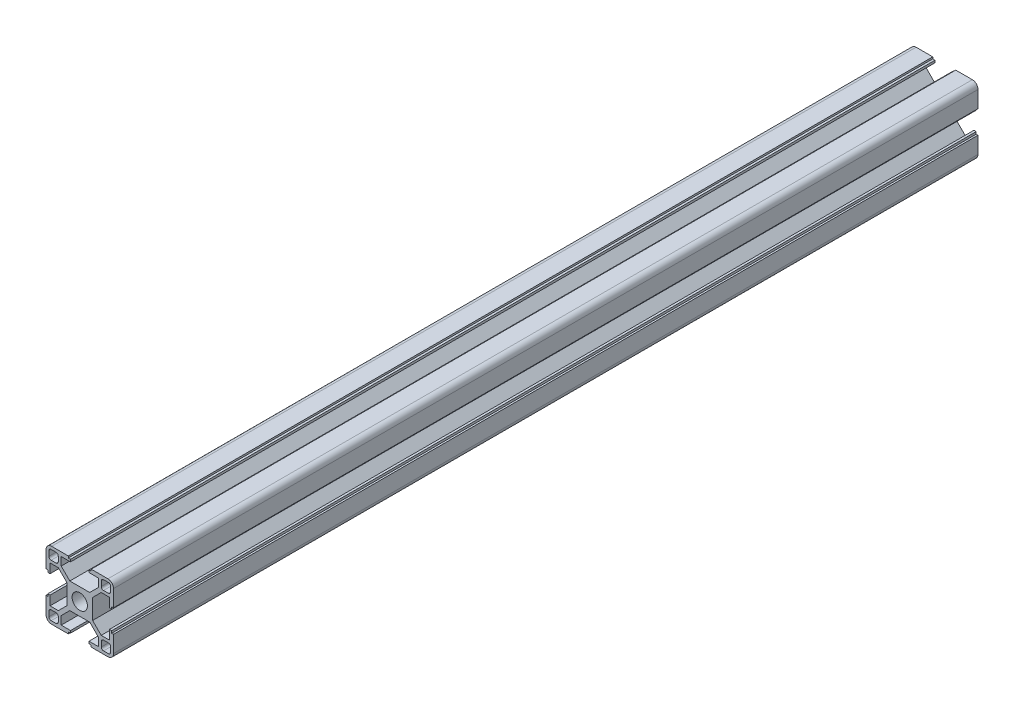
from build123d import *

# Parameters (mm, degrees)
SKETCH1_R      = 3.4
EXTRUDE1_DEPTH = 384
EXTRUDE2_DEPTH = 385.585491146


with BuildPart() as part:
    # Sketch1 → Extrude1 (new body)
    with BuildSketch(Plane.XY):
        with BuildLine():
            Line((-5.1, 14.2), (-5.1, 15))
            Line((-5.1, 15), (-12.5, 15))
            ThreePointArc((-12.5, 15), (-14.267766953, 14.267766953), (-15, 12.5))
            Line((-15, 12.5), (-15, 5.1))
            Line((-15, 5.1), (-14.2, 5.1))
            Line((-14.2, 5.1), (-14.2, 4.1))
            Line((-14.2, 4.1), (-13.2, 4.1))
            Line((-13.2, 4.1), (-13.2, 8.25))
            Line((-13.2, 8.25), (-9.522792206, 8.25))
            Line((-9.522792206, 8.25), (-5.7, 4.427207794))
            Line((-5.7, 4.427207794), (-5.7, -4.427207794))
            Line((-5.7, -4.427207794), (-9.522792206, -8.25))
            Line((-9.522792206, -8.25), (-13.2, -8.25))
            Line((-13.2, -8.25), (-13.2, -4.1))
            Line((-13.2, -4.1), (-14.2, -4.1))
            Line((-14.2, -4.1), (-14.2, -5.1))
            Line((-14.2, -5.1), (-15, -5.1))
            Line((-15, -5.1), (-15, -12.5))
            ThreePointArc((-15, -12.5), (-14.267766953, -14.267766953), (-12.5, -15))
            Line((-12.5, -15), (-5.1, -15))
            Line((-5.1, -15), (-5.1, -14.2))
            Line((-5.1, -14.2), (-4.1, -14.2))
            Line((-4.1, -14.2), (-4.1, -13.2))
            Line((-4.1, -13.2), (-8.25, -13.2))
            Line((-8.25, -13.2), (-8.25, -9.522792206))
            Line((-8.25, -9.522792206), (-4.427207794, -5.7))
            Line((-4.427207794, -5.7), (4.427207794, -5.7))
            Line((4.427207794, -5.7), (8.25, -9.522792206))
            Line((8.25, -9.522792206), (8.25, -13.2))
            Line((8.25, -13.2), (4.1, -13.2))
            Line((4.1, -13.2), (4.1, -14.2))
            Line((4.1, -14.2), (5.1, -14.2))
            Line((5.1, -14.2), (5.1, -15))
            Line((5.1, -15), (12.5, -15))
            ThreePointArc((12.5, -15), (14.267766953, -14.267766953), (15, -12.5))
            Line((15, -12.5), (15, -5.1))
            Line((15, -5.1), (14.2, -5.1))
            Line((14.2, -5.1), (14.2, -4.1))
            Line((14.2, -4.1), (13.2, -4.1))
            Line((13.2, -4.1), (13.2, -8.25))
            Line((13.2, -8.25), (9.522792206, -8.25))
            Line((9.522792206, -8.25), (5.7, -4.427207794))
            Line((5.7, -4.427207794), (5.7, 4.427207794))
            Line((5.7, 4.427207794), (9.522792206, 8.25))
            Line((9.522792206, 8.25), (13.2, 8.25))
            Line((13.2, 8.25), (13.2, 4.1))
            Line((13.2, 4.1), (14.2, 4.1))
            Line((14.2, 4.1), (14.2, 5.1))
            Line((14.2, 5.1), (15, 5.1))
            Line((15, 5.1), (15, 12.5))
            ThreePointArc((15, 12.5), (14.267766953, 14.267766953), (12.5, 15))
            Line((12.5, 15), (5.1, 15))
            Line((5.1, 15), (5.1, 14.2))
            Line((5.1, 14.2), (4.1, 14.2))
            Line((4.1, 14.2), (4.1, 13.2))
            Line((4.1, 13.2), (8.25, 13.2))
            Line((8.25, 13.2), (8.25, 9.522792206))
            Line((8.25, 9.522792206), (4.427207794, 5.7))
            Line((4.427207794, 5.7), (-4.427207794, 5.7))
            Line((-4.427207794, 5.7), (-8.25, 9.522792206))
            Line((-8.25, 9.522792206), (-8.25, 13.2))
            Line((-8.25, 13.2), (-4.1, 13.2))
            Line((-4.1, 13.2), (-4.1, 14.2))
            Line((-4.1, 14.2), (-5.1, 14.2))
        make_face()
        Circle(SKETCH1_R, mode=Mode.SUBTRACT)
    extrude(amount=EXTRUDE1_DEPTH)

    # Sketch2 → Extrude2 (cut, through all)
    with BuildSketch(Plane.XY.offset(384)):
        with BuildLine():
            Line((13.7, 12.7), (13.7, 10.55))
            ThreePointArc((13.7, 10.55), (13.407106781, 9.842893219), (12.7, 9.55))
            Line((12.7, 9.55), (10.55, 9.55))
            ThreePointArc((10.55, 9.55), (9.842893219, 9.842893219), (9.55, 10.55))
            Line((9.55, 10.55), (9.55, 12.7))
            ThreePointArc((9.55, 12.7), (9.842893219, 13.407106781), (10.55, 13.7))
            Line((10.55, 13.7), (12.7, 13.7))
            ThreePointArc((12.7, 13.7), (13.407106781, 13.407106781), (13.7, 12.7))
        make_face()
        with BuildLine():
            Line((-12.7, 13.7), (-10.55, 13.7))
            ThreePointArc((-10.55, 13.7), (-9.842893219, 13.407106781), (-9.55, 12.7))
            Line((-9.55, 12.7), (-9.55, 10.55))
            ThreePointArc((-9.55, 10.55), (-9.842893219, 9.842893219), (-10.55, 9.55))
            Line((-10.55, 9.55), (-12.7, 9.55))
            ThreePointArc((-12.7, 9.55), (-13.407106781, 9.842893219), (-13.7, 10.55))
            Line((-13.7, 10.55), (-13.7, 12.7))
            ThreePointArc((-13.7, 12.7), (-13.407106781, 13.407106781), (-12.7, 13.7))
        make_face()
        with BuildLine():
            Line((12.7, -13.7), (10.55, -13.7))
            ThreePointArc((10.55, -13.7), (9.842893219, -13.407106781), (9.55, -12.7))
            Line((9.55, -12.7), (9.55, -10.55))
            ThreePointArc((9.55, -10.55), (9.842893219, -9.842893219), (10.55, -9.55))
            Line((10.55, -9.55), (12.7, -9.55))
            ThreePointArc((12.7, -9.55), (13.407106781, -9.842893219), (13.7, -10.55))
            Line((13.7, -10.55), (13.7, -12.7))
            ThreePointArc((13.7, -12.7), (13.407106781, -13.407106781), (12.7, -13.7))
        make_face()
        with BuildLine():
            Line((-13.7, -12.7), (-13.7, -10.55))
            ThreePointArc((-13.7, -10.55), (-13.407106781, -9.842893219), (-12.7, -9.55))
            Line((-12.7, -9.55), (-10.55, -9.55))
            ThreePointArc((-10.55, -9.55), (-9.842893219, -9.842893219), (-9.55, -10.55))
            Line((-9.55, -10.55), (-9.55, -12.7))
            ThreePointArc((-9.55, -12.7), (-9.842893219, -13.407106781), (-10.55, -13.7))
            Line((-10.55, -13.7), (-12.7, -13.7))
            ThreePointArc((-12.7, -13.7), (-13.407106781, -13.407106781), (-13.7, -12.7))
        make_face()
    extrude(amount=-EXTRUDE2_DEPTH, mode=Mode.SUBTRACT)


solid = part.part
